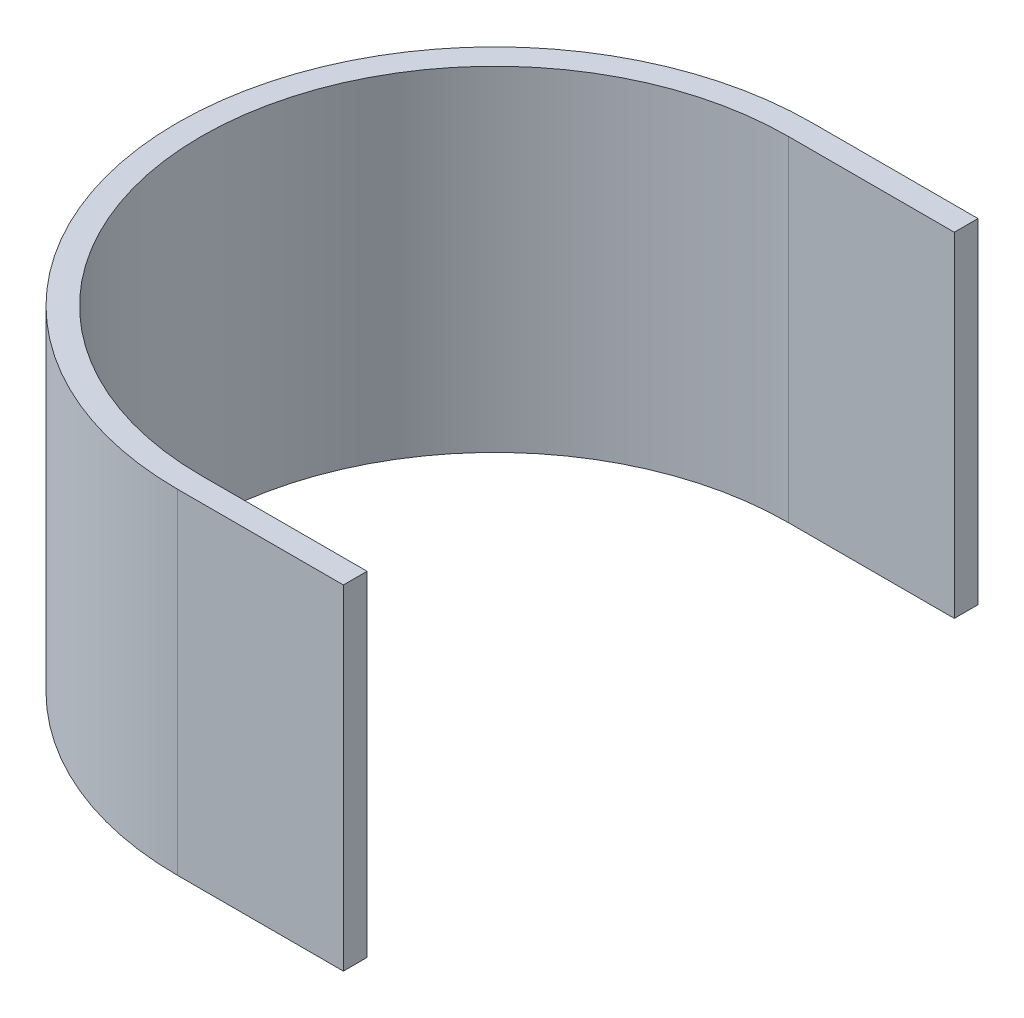
from build123d import *

# Parameters (mm, degrees)
BOSS_EXTRUDE1_DEPTH = 25.4


with BuildPart() as part:
    # Sketch1 → Boss-Extrude1 (new body)
    with BuildSketch(Plane(origin=(0, 0, 0), x_dir=(1, 0, 0), z_dir=(0, 1, 0))):
        with BuildLine():
            Line((24.755784885, -3.322545253), (37.356972885, -3.322545253))
            Line((37.356972885, -3.322545253), (37.356972885, -5.122545253))
            Line((37.356972885, -5.122545253), (24.755784885, -5.122545253))
            ThreePointArc((24.755784885, -5.122545253), (0.65805188, 18.975187752), (24.755784885, 43.072920757))
            Line((24.755784885, 43.072920757), (37.356972885, 43.072920757))
            Line((37.356972885, 43.072920757), (37.356972885, 41.272920757))
            Line((37.356972885, 41.272920757), (24.755784885, 41.272920757))
            ThreePointArc((24.755784885, 41.272920757), (2.45805188, 18.975187752), (24.755784885, -3.322545253))
        make_face()
    extrude(amount=BOSS_EXTRUDE1_DEPTH)


solid = part.part
